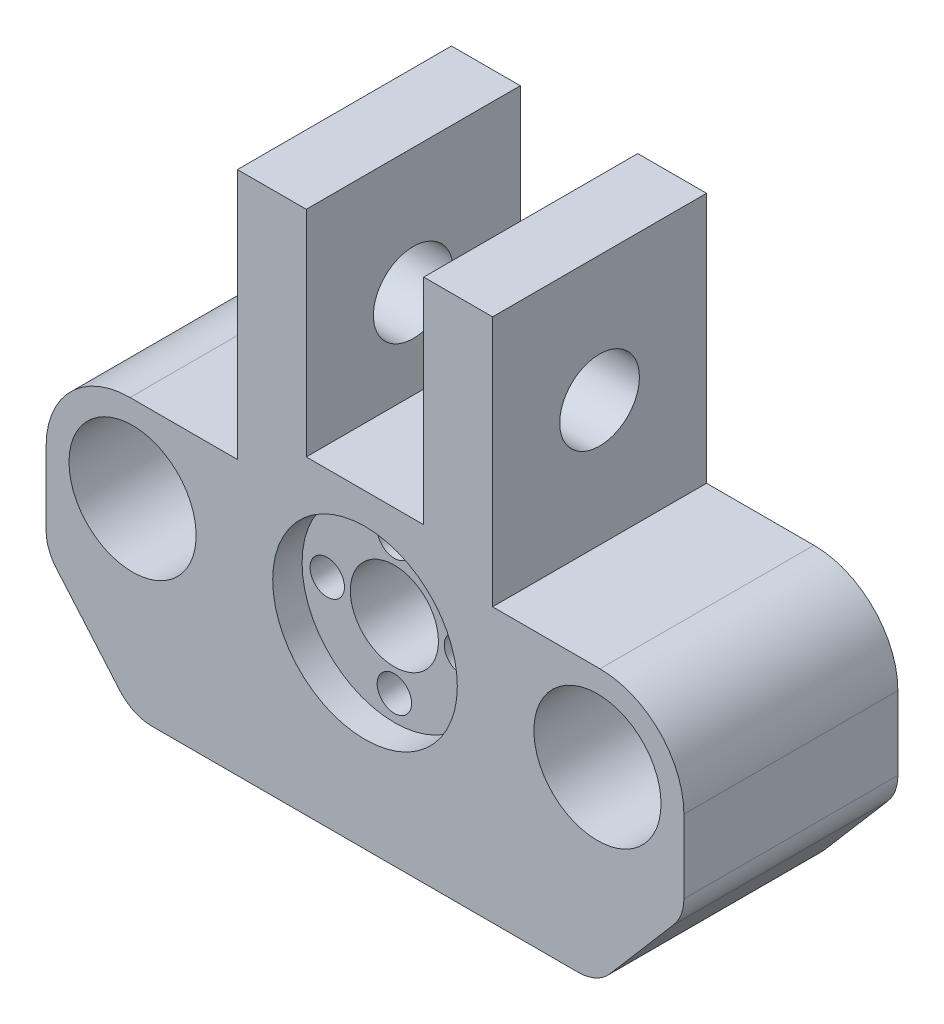
from build123d import *

# Parameters (mm, degrees)
CROQUIS1_R              = 7.575
SALIENTE_EXTRUIR1_DEPTH = 25.5
BOSS_EXTRUDE1_DEPTH     = 25.5
SKETCH7_R               = 11
CUT_EXTRUDE1_DEPTH      = 3.5
SKETCH9_R               = 5.25
CUT_EXTRUDE3_DEPTH      = 22
REDONDEO1_R             = 10
FILLET1_R               = 5
SKETCH8_R               = 4.75
CUT_EXTRUDE2_DEPTH      = 88.312260382
SKETCH11_R              = 2.05
CUT_EXTRUDE4_DEPTH      = 10


with BuildPart() as part:
    # Croquis1 → Saliente-Extruir1 (new body)
    with BuildSketch(Plane.XY):
        Polygon((79.406412185, 15.36568027), (79.406412185, 34.441404803), (102.206412031, 34.441404803), (102.206412031, 13.841404803), (91.906412031, 1.820896426), (36.506412031, 1.820896426), (26.206412031, 13.841404803), (26.206412031, 34.441404803), (49.006411878, 34.441404803), (49.006411878, 15.36568027), (64.10641184, 6.647691683), (64.206412031, 6.589956548), (64.306412223, 6.647691683), align=None)
        with Locations((91.906412031, 24.141404803)):
            Circle(CROQUIS1_R, mode=Mode.SUBTRACT)
        with Locations(Location((36.506412031, 24.141404803, 0), (0, 0, 180))):
            Circle(CROQUIS1_R, mode=Mode.SUBTRACT)
    extrude(amount=-SALIENTE_EXTRUIR1_DEPTH)

    # Sketch4 → Boss-Extrude1 (add)
    with BuildSketch(Plane.XY):
        Polygon((64.206412031, 6.589956548), (79.406412185, 15.36568027), (79.406412185, 64.36568027), (71.206412031, 64.36568027), (71.206412031, 38.80809142), (57.206412031, 38.80809142), (57.206412031, 64.36568027), (49.006411878, 64.36568027), (49.006411878, 15.36568027), align=None)
    extrude(amount=-BOSS_EXTRUDE1_DEPTH)

    # Sketch7 → Cut-Extrude1 (cut)
    with BuildSketch(Plane.XY):
        with Locations((64.206412031, 24.141404803)):
            Circle(SKETCH7_R)
    extrude(amount=-CUT_EXTRUDE1_DEPTH, mode=Mode.SUBTRACT)

    # Sketch9 → Cut-Extrude3 (cut)
    with BuildSketch(Plane.XY.offset(-3.5)):
        with Locations((64.206412031, 24.141404803)):
            Circle(SKETCH9_R)
    extrude(amount=-CUT_EXTRUDE3_DEPTH, mode=Mode.SUBTRACT)

    # Redondeo1
    redondeo1_edges = [part.edges().sort_by_distance(p)[0] for p in [
        (102.206412031, 34.441404803, -12.75),
        (26.206412031, 34.441404803, -12.75),
    ]]
    fillet(redondeo1_edges, radius=REDONDEO1_R)

    # Fillet1
    fillet1_edges = [part.edges().sort_by_distance(p)[0] for p in [
        (102.206412031, 13.841404803, -12.75),
        (91.906412031, 1.820896426, -12.75),
        (36.506412031, 1.820896426, -12.75),
        (26.206412031, 13.841404803, -12.75),
    ]]
    fillet(fillet1_edges, radius=FILLET1_R)

    # Sketch8 → Cut-Extrude2 (cut, through all)
    with BuildSketch(Plane(origin=(79.406412185, 0, 0), x_dir=(0, 0, -1), z_dir=(1, 0, 0))):
        with Locations((12.75, 49.403542537)):
            Circle(SKETCH8_R)
    extrude(amount=-CUT_EXTRUDE2_DEPTH, mode=Mode.SUBTRACT)

    # Sketch11 → Cut-Extrude4 (cut)
    with BuildSketch(Plane.XY.offset(-3.5)):
        with Locations((72.206412031, 24.141404803)):
            Circle(SKETCH11_R)
        with Locations((64.206412031, 32.141404803)):
            Circle(SKETCH11_R)
        with Locations((56.206412031, 24.141404803)):
            Circle(SKETCH11_R)
        with Locations((64.206412031, 16.141404803)):
            Circle(SKETCH11_R)
    extrude(amount=-CUT_EXTRUDE4_DEPTH, mode=Mode.SUBTRACT)


solid = part.part
